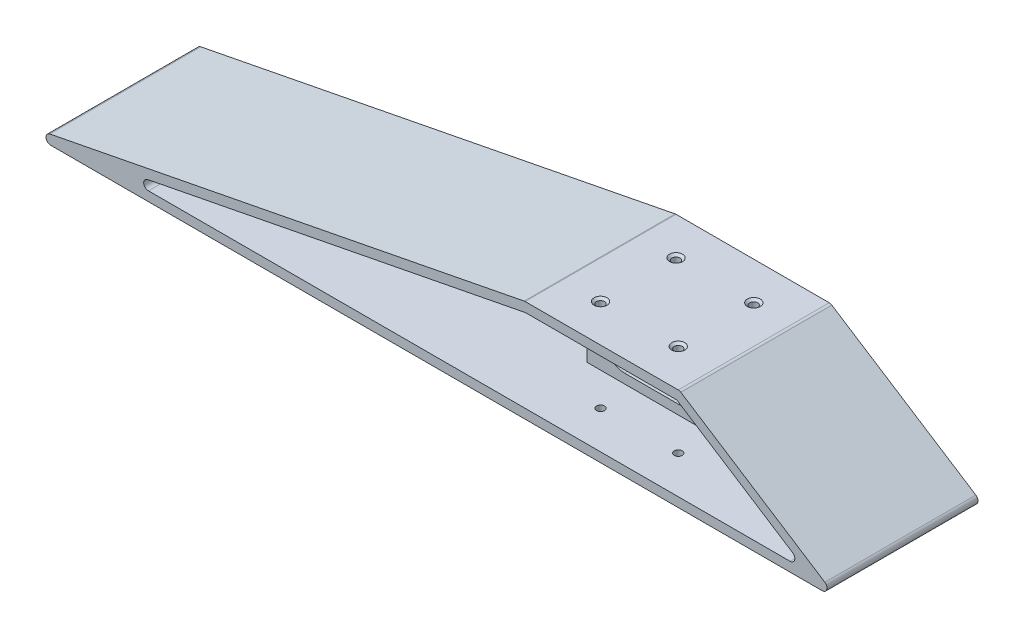
from build123d import *

# Parameters (mm, degrees)
BOSS_EXTRUDE1_DEPTH                               = 50.8
FILLET1_R                                         = 1.5875
SKETCH3_W                                         = 50.927
SKETCH3_H                                         = 3.175
BOSS_EXTRUDE2_DEPTH                               = 27.94
SKETCH4_W                                         = 44.577
SKETCH4_H                                         = 21.59
CUT_EXTRUDE1_DEPTH                                = 3.175
FILLET2_R                                         = 6.35
SKETCH6_W                                         = 1.016
SKETCH6_H                                         = 10.0076
BOSS_EXTRUDE3_DEPTH                               = 3.175
CSK_FOR_2_FLAT_HEAD_MACHINE_SCREW_100_D           = 2.7051
CSK_FOR_2_FLAT_HEAD_MACHINE_SCREW_100_CSINK_D     = 4.3688
CSK_FOR_2_FLAT_HEAD_MACHINE_SCREW_100_CSINK_ANGLE = 100


with BuildPart() as part:
    # Sketch1 → Boss-Extrude1 (new body)
    with BuildSketch(Plane.XY):
        Polygon((143.005117829, 31.115), (-32.877459737, -3.175), (248.569196095, -3.175), (195.170369003, 31.115), align=None)
        with BuildLine():
            Line((16.438729869, 0), (232.338729869, 0))
            ThreePointArc((232.338729869, 0), (233.862005994, 1.140525622), (233.196513049, 2.923300983))
            Line((233.196513049, 2.923300983), (194.238729869, 27.94))
            Line((194.238729869, 27.94), (143.311729869, 27.94))
            Line((143.311729869, 27.94), (16.134950843, 3.14566384))
            ThreePointArc((16.134950843, 3.14566384), (14.858580928, 1.434903877), (16.438729869, 0))
        make_face(mode=Mode.SUBTRACT)
    extrude(amount=BOSS_EXTRUDE1_DEPTH)

    # Fillet1
    fillet1_edges = [part.edges().sort_by_distance(p)[0] for p in [
        (195.170369003, 31.115, 25.4),
        (248.569196095, -3.175, 25.4),
        (-32.877459737, -3.175, 25.4),
        (143.005117829, 31.115, 25.4),
    ]]
    fillet(fillet1_edges, radius=FILLET1_R)

    # Sketch3 → Boss-Extrude2 (add)
    with BuildSketch(Plane.XZ.offset(-27.94)):
        with Locations((168.775229869, 25.4)):
            Rectangle(SKETCH3_W, SKETCH3_H)
    extrude(amount=BOSS_EXTRUDE2_DEPTH)

    # Sketch4 → Cut-Extrude1 (cut)
    with BuildSketch(Plane(origin=(0, 0, 23.8125), x_dir=(-1, 0, 0), z_dir=(0, 0, -1))):
        with Locations((-168.775229869, 13.97)):
            Rectangle(SKETCH4_W, SKETCH4_H)
    extrude(amount=-CUT_EXTRUDE1_DEPTH, mode=Mode.SUBTRACT)

    # Fillet2
    fillet2_edges = [part.edges().sort_by_distance(p)[0] for p in [
        (191.063729869, 24.765, 25.4),
        (146.486729869, 24.765, 25.4),
        (146.486729869, 3.175, 25.4),
        (191.063729869, 3.175, 25.4),
    ]]
    fillet(fillet2_edges, radius=FILLET2_R)

    # Sketch6 → Boss-Extrude3 (add)
    with BuildSketch(Plane.XY.offset(26.9875)):
        Polygon((143.311729869, 0), (140.136729869, 0), (140.136729869, 27.321003215), (143.311729869, 27.94), align=None)
        with Locations((141.724229869, 13.97)):
            Rectangle(SKETCH6_W, SKETCH6_H, mode=Mode.SUBTRACT)
    extrude(amount=-BOSS_EXTRUDE3_DEPTH)

    # CSK for #2 Flat Head Machine Screw (100)1 (through all)
    with Locations(Plane(origin=(0, 31.115, 0), x_dir=(1, 0, 0), z_dir=(0, 1, 0))):
        with Locations((155.858423849, -12.7), (182.004549436, -12.7), (182.004549436, -38.1), (155.858423849, -38.1)):
            CounterSinkHole(CSK_FOR_2_FLAT_HEAD_MACHINE_SCREW_100_D / 2, CSK_FOR_2_FLAT_HEAD_MACHINE_SCREW_100_CSINK_D / 2, counter_sink_angle=CSK_FOR_2_FLAT_HEAD_MACHINE_SCREW_100_CSINK_ANGLE)


solid = part.part
